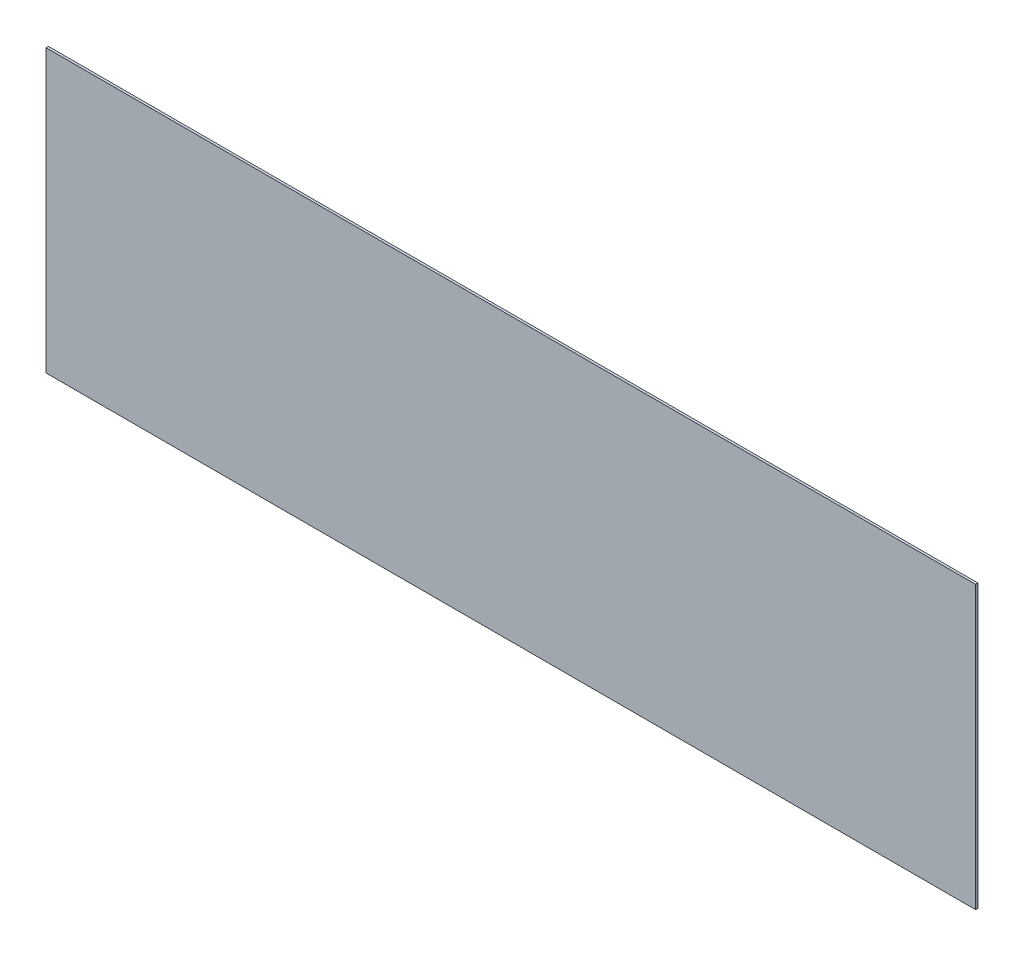
from build123d import *

# Parameters (mm, degrees)
SKETCH1_W           = 585.4
SKETCH1_H           = 177.4
BOSS_EXTRUDE1_DEPTH = 1.5


with BuildPart() as part:
    # Sketch1 → Boss-Extrude1 (new body)
    with BuildSketch(Plane.XY):
        with Locations((176.056550919, -47.252553926)):
            Rectangle(SKETCH1_W, SKETCH1_H)
    extrude(amount=BOSS_EXTRUDE1_DEPTH)


solid = part.part
